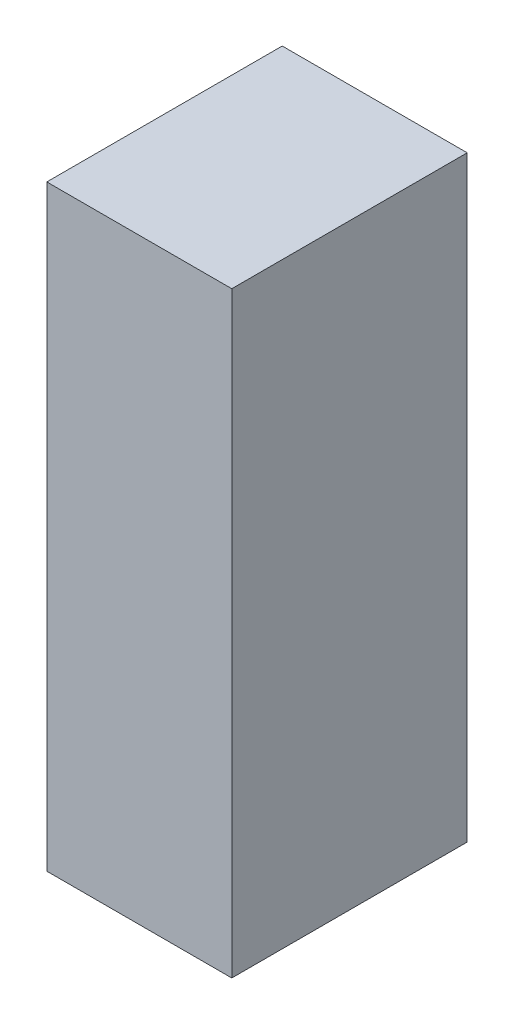
from build123d import *

# Parameters (mm, degrees)
SKETCH_1_W        = 44
SKETCH_1_H        = 142
EXTRUDE_210_DEPTH = 56


with BuildPart() as part:
    # 草图1 → Extrude 210 (new body)
    with BuildSketch(Plane.XY):
        Rectangle(SKETCH_1_W, SKETCH_1_H)
    extrude(amount=EXTRUDE_210_DEPTH)


solid = part.part
